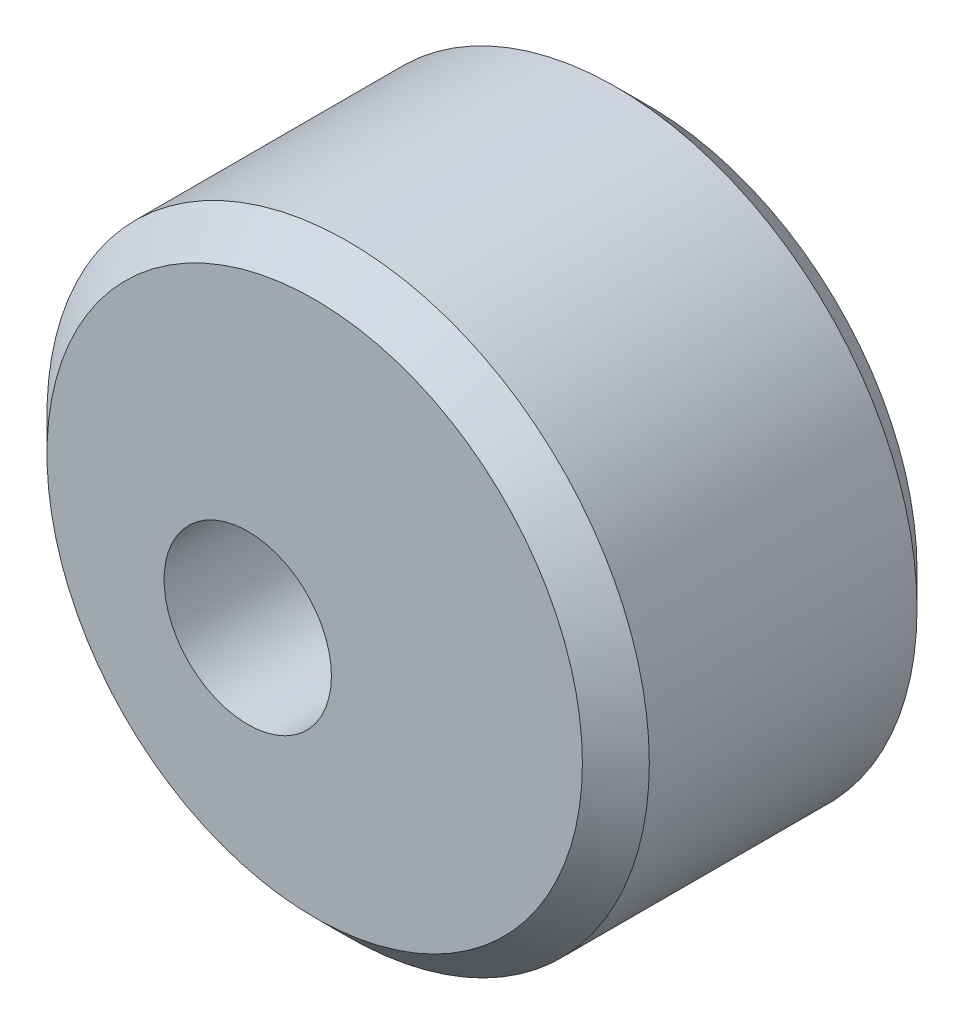
from build123d import *

# Parameters (mm, degrees)
SKETCH_1_R         = 9
EXTRUDE_1_DEPTH    = 5
CHAMFER_1_SIZE     = 1
HOLE_WIZARD_M6_1_D = 5


with BuildPart() as part:
    # 草图1 → 凸台-拉伸1 (new, symmetric)
    with BuildSketch(Plane.XY):
        Circle(SKETCH_1_R)
    extrude(amount=EXTRUDE_1_DEPTH, both=True)

    # 倒角1
    chamfer_1_edges = [part.edges().sort_by_distance(p)[0] for p in [
        (-9, 0, -5),
        (-9, 0, 5),
    ]]
    chamfer(chamfer_1_edges, length=CHAMFER_1_SIZE)

    # M6 螺纹孔1 (through all)
    with Locations(Plane.XY.offset(5)):
        with Locations((-2, -1.5)):
            Hole(HOLE_WIZARD_M6_1_D / 2)

    # 草图5 → 切除-旋转1 (revolve, cut)
    with BuildSketch(Plane(origin=(0, 0, 0), x_dir=(0, 0, -1), z_dir=(1, 0, 0))):
        Polygon((0, -9), (0, -6.5), (2.5, -9), align=None)
    revolve(axis=Axis((0, -9, 0), (0, 1, 0)), mode=Mode.SUBTRACT)


solid = part.part
